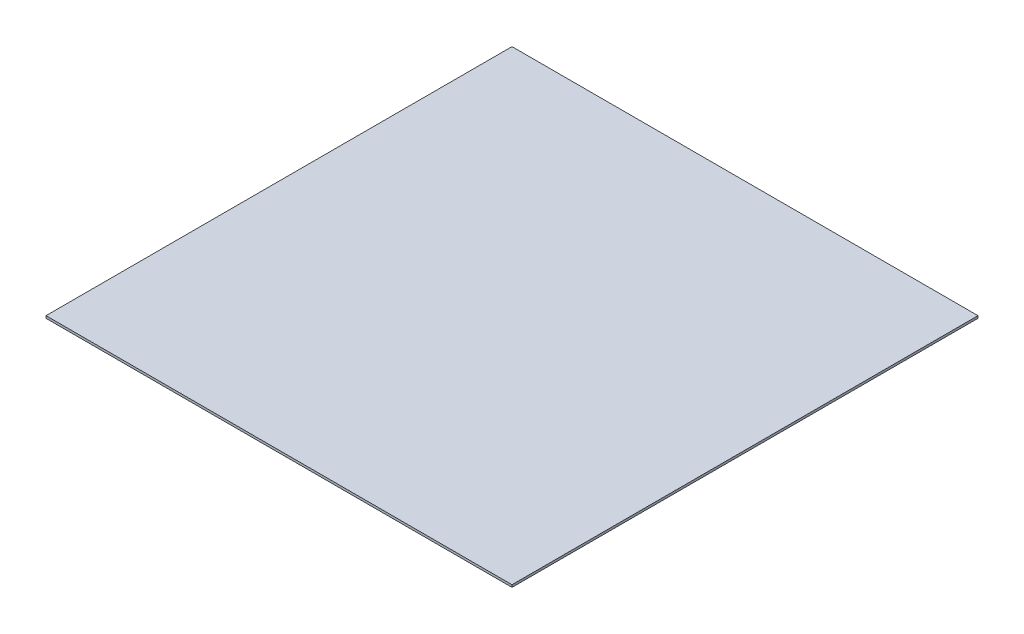
from build123d import *

# Parameters (mm, degrees)
SKETCH1_W           = 1000
SKETCH1_H           = 1000
BOSS_EXTRUDE1_DEPTH = 2.5


with BuildPart() as part:
    # Sketch1 → Boss-Extrude1 (new, symmetric)
    with BuildSketch(Plane(origin=(0, 0, 0), x_dir=(1, 0, 0), z_dir=(0, 1, 0))):
        Rectangle(SKETCH1_W, SKETCH1_H)
    extrude(amount=BOSS_EXTRUDE1_DEPTH, both=True)


solid = part.part
